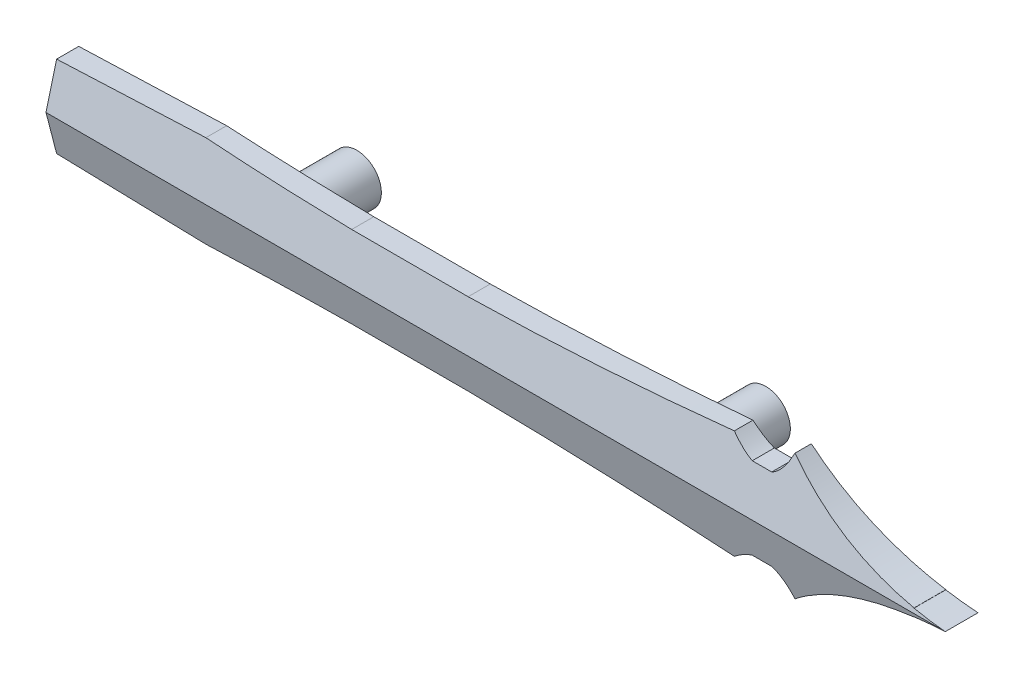
from build123d import *

# Parameters (mm, degrees)
SKIZZE1_W                       = 53
SKIZZE1_H                       = 5
AUFSATZ_LINEAR_AUSTRAGEN1_DEPTH = 2
SKIZZE2_R                       = 1.5
AUFSATZ_LINEAR_AUSTRAGEN2_DEPTH = 4
AUFSATZ_LINEAR_AUSTRAGEN3_DEPTH = 2
SCHNITT_LINEAR_AUSTRAGEN1_DEPTH = 2
SCHNITT_LINEAR_AUSTRAGEN2_DEPTH = 62


with BuildPart() as part:
    # Skizze1 → Aufsatz-Linear austragen1 (new body)
    with BuildSketch(Plane.XY):
        with Locations((26.5, 2.5)):
            Rectangle(SKIZZE1_W, SKIZZE1_H)
    extrude(amount=AUFSATZ_LINEAR_AUSTRAGEN1_DEPTH)

    # Skizze2 → Aufsatz-Linear austragen2 (add)
    with BuildSketch(Plane(origin=(0, 0, 0), x_dir=(-1, 0, 0), z_dir=(0, 0, -1))):
        with Locations((-38, 2.5)):
            Circle(SKIZZE2_R)
        with Locations((-13, 2.5)):
            Circle(SKIZZE2_R)
    extrude(amount=AUFSATZ_LINEAR_AUSTRAGEN2_DEPTH)

    # Skizze3 → Aufsatz-Linear austragen3 (add)
    with BuildSketch(Plane.XY.offset(2)):
        with BuildLine():
            Line((9.041652249, 5.319771497), (0, 5))
            Line((0, 5), (0, 0))
            Line((0, 0), (9.041652249, -0.319771497))
            add(Edge.make_bspline(
                [(41.214812909, -0.82086692), (25.128158575, 0.571238551), (9.041652249, -0.319771497)],
                knots=[0, 0, 0, 1, 1, 1], degree=2))
            add(Edge.make_bspline(
                [(44.782995012, -1.356094236), (43.718693427, 1.301548712), (41.214812909, -0.82086692)],
                knots=[0, 0, 0, 1, 1, 1], degree=2))
            add(Edge.make_bspline(
                [(54.97075372, 2.5), (49.140580599, 2.096719237), (44.782995012, -1.356094236)],
                knots=[0, 0, 0, 1, 1, 1], degree=2))
            add(Edge.make_bspline(
                [(54.97075372, 2.5), (49.140580599, 2.903280763), (44.782995012, 6.356094236)],
                knots=[0, 0, 0, 1, 1, 1], degree=2))
            add(Edge.make_bspline(
                [(44.782995012, 6.356094236), (43.718693427, 3.698451288), (41.214812909, 5.82086692)],
                knots=[0, 0, 0, 1, 1, 1], degree=2))
            add(Edge.make_bspline(
                [(41.214812909, 5.82086692), (25.128158575, 4.428761449), (9.041652249, 5.319771497)],
                knots=[0, 0, 0, 1, 1, 1], degree=2))
        make_face()
    extrude(amount=-AUFSATZ_LINEAR_AUSTRAGEN3_DEPTH)

    # Skizze4 → Schnitt-Linear austragen1 (cut)
    with BuildSketch(Plane.XY.offset(2)):
        with BuildLine():
            Line((44.782995012, -1.356094236), (55.574942563, -1.356094236))
            Line((55.574942563, -1.356094236), (55.574942563, 6.356094236))
            Line((55.574942563, 6.356094236), (44.782995012, 6.356094236))
            add(Edge.make_bspline(
                [(44.782995012, 6.356094236), (48.809965084, 2.992691468), (54.97075372, 2.5)],
                knots=[0, 0, 0, 1, 1, 1], degree=2))
            add(Edge.make_bspline(
                [(44.782995012, -1.356094236), (48.809965084, 2.007308532), (54.97075372, 2.5)],
                knots=[0, 0, 0, 1, 1, 1], degree=2))
        make_face()
    extrude(amount=-SCHNITT_LINEAR_AUSTRAGEN1_DEPTH, mode=Mode.SUBTRACT)

    # Skizze5 → Schnitt-Linear austragen2 (cut)
    with BuildSketch(Plane.ZY):
        Polygon((1, 6.356094236), (2, 2.5), (1, -1.356094236), (2.237806681, -1.356094236), (2.319741109, 6.356094236), align=None)
    extrude(amount=-SCHNITT_LINEAR_AUSTRAGEN2_DEPTH, mode=Mode.SUBTRACT)


solid = part.part
